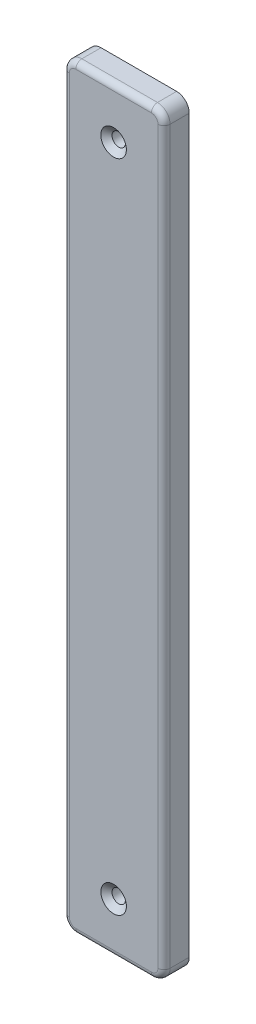
from build123d import *

# Parameters (mm, degrees)
SKETCH1_W                                           = 50.8
SKETCH1_H                                           = 381
BASE_EXTRUDE_DEPTH                                  = 12.7
CSK_FOR_1_4_FLAT_HEAD_MACHINE_SCREW_100_D           = 6.7564
CSK_FOR_1_4_FLAT_HEAD_MACHINE_SCREW_100_CSINK_D     = 12.8778
CSK_FOR_1_4_FLAT_HEAD_MACHINE_SCREW_100_CSINK_ANGLE = 100
FILLET1_R                                           = 6.35
FILLET2_R                                           = 3.048


with BuildPart() as part:
    # Sketch1 → Base-Extrude (new body)
    with BuildSketch(Plane.XY):
        Rectangle(SKETCH1_W, SKETCH1_H)
    extrude(amount=BASE_EXTRUDE_DEPTH)

    # CSK for 1/4 Flat Head Machine Screw (100)1 (through all)
    with Locations(Plane.XY.offset(12.7)):
        with Locations((0, 165.1), (0, -165.1)):
            CounterSinkHole(CSK_FOR_1_4_FLAT_HEAD_MACHINE_SCREW_100_D / 2, CSK_FOR_1_4_FLAT_HEAD_MACHINE_SCREW_100_CSINK_D / 2, counter_sink_angle=CSK_FOR_1_4_FLAT_HEAD_MACHINE_SCREW_100_CSINK_ANGLE)

    # Fillet1
    fillet1_edges = [part.edges().sort_by_distance(p)[0] for p in [
        (25.4, -190.5, 6.35),
        (-25.4, -190.5, 6.35),
        (-25.4, 190.5, 6.35),
        (25.4, 190.5, 6.35),
    ]]
    fillet(fillet1_edges, radius=FILLET1_R)

    # Fillet2
    fillet2_edges = [part.edges().sort_by_distance(p)[0] for p in [
        (25.4, 0, 12.7),
        (0, -190.5, 12.7),
        (0, 190.5, 12.7),
        (-25.4, 0, 12.7),
        (23.540128061, 188.640128061, 12.7),
        (-23.540128061, 188.640128061, 12.7),
        (-23.540128061, -188.640128061, 12.7),
        (23.540128061, -188.640128061, 12.7),
    ]]
    fillet(fillet2_edges, radius=FILLET2_R)


solid = part.part
